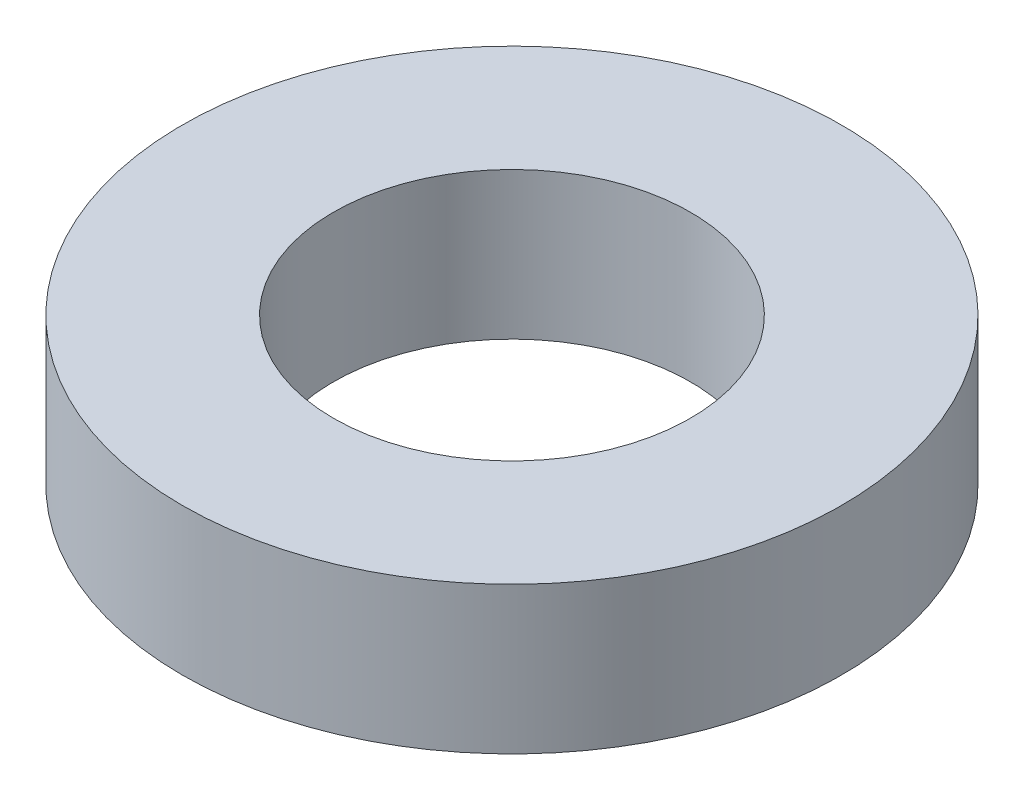
from build123d import *

# Parameters (mm, degrees)
SKETCH1_R           = 6
SKETCH1_R_2         = 3.25
BOSS_EXTRUDE1_DEPTH = 1.3375


with BuildPart() as part:
    # Sketch1 → Boss-Extrude1 (new, symmetric)
    with BuildSketch(Plane(origin=(0, 0, 0), x_dir=(1, 0, 0), z_dir=(0, 1, 0))):
        with Locations(Location((0, 0, 0), (0, 0, 270))):
            Circle(SKETCH1_R)
        with Locations(Location((0, 0, 0), (0, 0, 270))):
            Circle(SKETCH1_R_2, mode=Mode.SUBTRACT)
    extrude(amount=BOSS_EXTRUDE1_DEPTH, both=True)


solid = part.part
